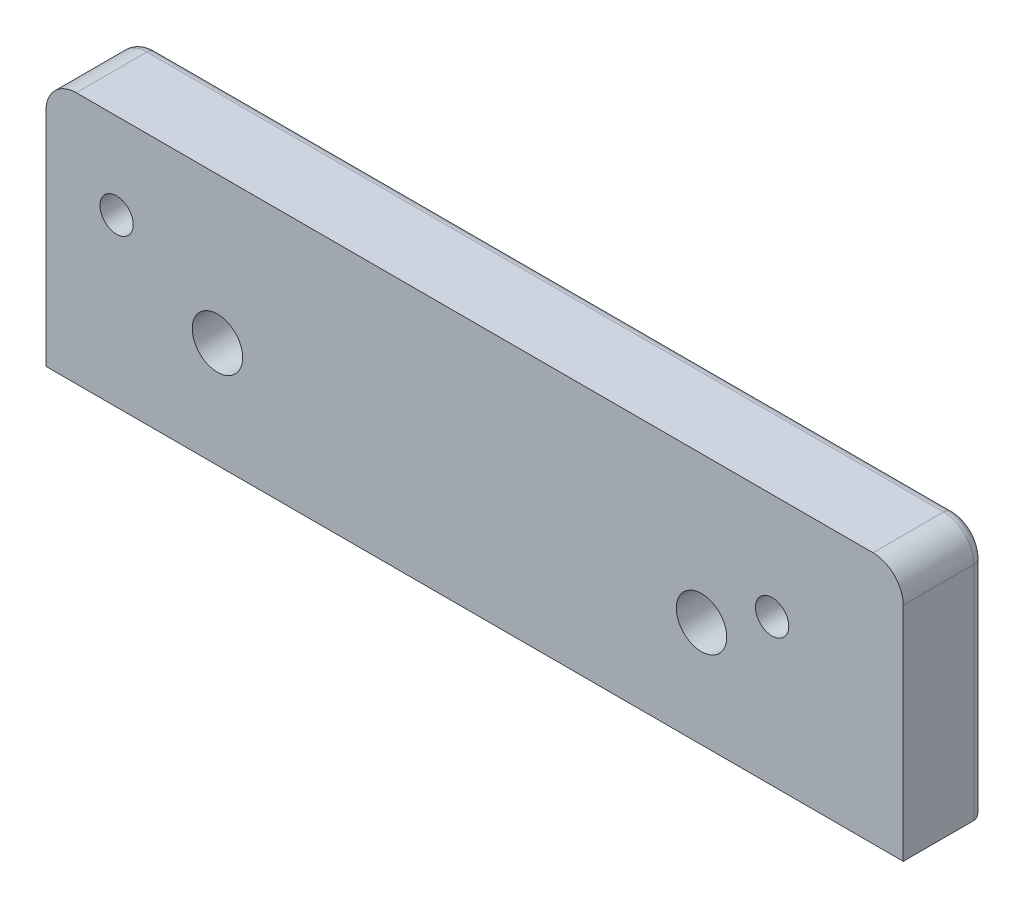
from build123d import *

# Parameters (mm, degrees)
ESQUISSE1_W                = 85
ESQUISSE1_H                = 25
BASE_EXTRUSION_DEPTH       = 8
CONG_1_R                   = 3
CONG_4_R                   = 1
ESQUISSE2_R                = 2.5
ENL_V_MAT_EXTRU_1_DEPTH    = 8
ESQUISSE4_R                = 1.65
ENL_V_MAT_EXTRU_3_DEPTH    = 8
ESQUISSE12_R               = 4.3
ENL_V_MAT_EXTRU_6_DEPTH    = 4
ENL_V_MAT_EXTRU_7_DEPTH    = 84.553874835
R_P_TITION_LIN_AIRE1_COUNT = 85
R_P_TITION_LIN_AIRE1_PITCH = 1


with BuildPart() as part:
    # Esquisse1 → Base-Extrusion (new body)
    with BuildSketch(Plane.XY):
        with Locations((0, 2)):
            Rectangle(ESQUISSE1_W, ESQUISSE1_H)
    extrude(amount=BASE_EXTRUSION_DEPTH)

    # Congé1
    cong_1_edges = [part.edges().sort_by_distance(p)[0] for p in [
        (42.5, 14.5, 4),
        (-42.5, 14.5, 4),
    ]]
    fillet(cong_1_edges, radius=CONG_1_R)

    # Congé4
    cong_4_edges = [part.edges().sort_by_distance(p)[0] for p in [
        (42.5, 0.5, 0),
        (41.621320344, 13.621320344, 0),
        (0, -10.5, 0),
        (0, 14.5, 0),
        (-42.5, 0.5, 0),
        (-41.621320344, 13.621320344, 0),
    ]]
    fillet(cong_4_edges, radius=CONG_4_R)

    # Esquisse2 → Enlèv. mat.-Extru.1 (cut)
    with BuildSketch(Plane.XY.offset(8)):
        with Locations((-25.5, 0)):
            Circle(ESQUISSE2_R)
        with Locations((22.5, 0)):
            Circle(ESQUISSE2_R)
    extrude(amount=-ENL_V_MAT_EXTRU_1_DEPTH, mode=Mode.SUBTRACT)

    # Esquisse4 → Enlèv. mat.-Extru.3 (cut)
    with BuildSketch(Plane.XY.offset(8)):
        with Locations((-35.5, 6)):
            Circle(ESQUISSE4_R)
        with Locations((29.5, 4)):
            Circle(ESQUISSE4_R)
    extrude(amount=-ENL_V_MAT_EXTRU_3_DEPTH, mode=Mode.SUBTRACT)

    # Esquisse12 → Enlèv. mat.-Extru.6 (cut)
    with BuildSketch(Plane(origin=(0, 0, 0), x_dir=(-1, 0, 0), z_dir=(0, 0, -1))):
        with Locations((-22.5, 0)):
            Circle(ESQUISSE12_R)
        with Locations((25.5, 0)):
            Circle(ESQUISSE12_R)
    extrude(amount=-ENL_V_MAT_EXTRU_6_DEPTH, mode=Mode.SUBTRACT)

    # Esquisse13 → Enlèv. mat.-Extru.7 (cut, through all)
    with BuildSketch(Plane(origin=(37, 14.5, 2), x_dir=(-1, 0, 0), z_dir=(0, 1, 0))):
        Polygon((-5.100679677, -2.2), (-4.300679677, -2.2), (-4.700679677, -1.8), align=None)
    enl_v_mat_extru_7 = extrude(amount=-ENL_V_MAT_EXTRU_7_DEPTH, mode=Mode.SUBTRACT)

    # Répétition linéaire1: Enlèv. mat.-Extru.7 ×85
    with Locations(*[(-i * R_P_TITION_LIN_AIRE1_PITCH, 0, 0) for i in range(1, R_P_TITION_LIN_AIRE1_COUNT)]):
        add(enl_v_mat_extru_7, mode=Mode.SUBTRACT)


solid = part.part
